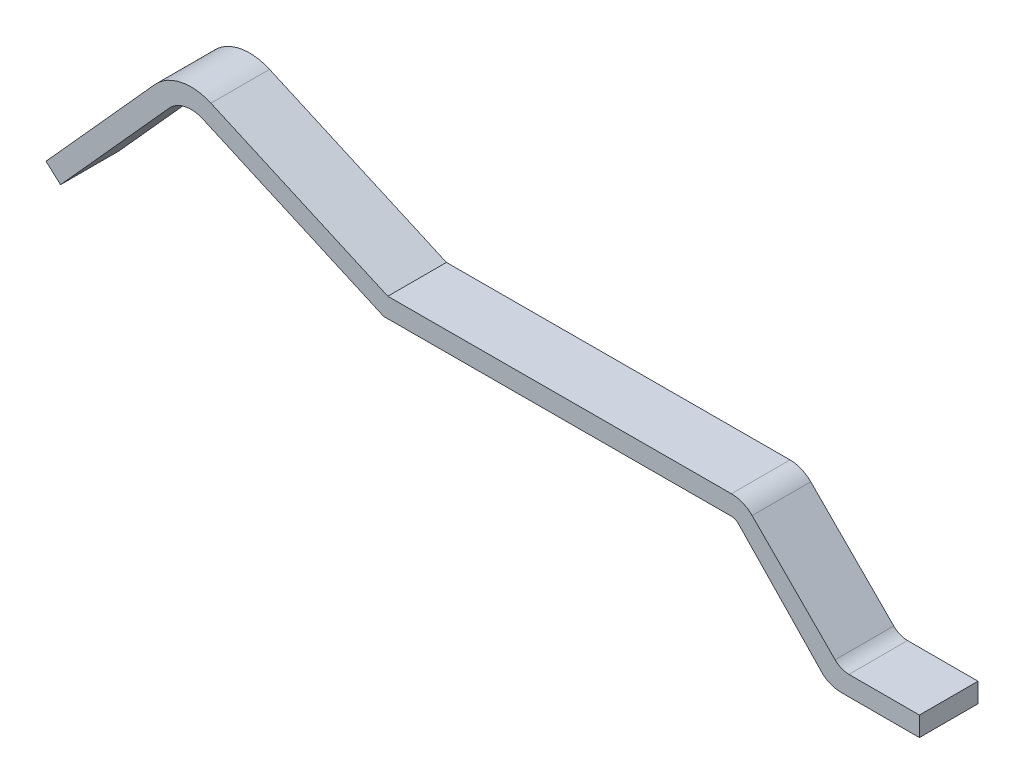
from build123d import *

# Parameters (mm, degrees)
RESSALTO_EXTRUS_O1_DEPTH = 0.3


with BuildPart() as part:
    # Esboço1 → Ressalto-extrusão1 (new, symmetric)
    with BuildSketch(Plane.XY):
        with BuildLine():
            Line((17.891752756, 0.197947805), (17.891752756, -0.002052195))
            Line((17.891752756, -0.002052195), (17.091752756, -0.002052195))
            ThreePointArc((17.091752756, -0.002052195), (16.996884427, 0.013342816), (16.911752756, 0.057947805))
            Line((16.911752756, 0.057947805), (16.038199366, 0.968756691))
            ThreePointArc((16.038199366, 0.968756691), (16.005773821, 0.990473944), (15.967488688, 0.99804386))
            Line((15.967488688, 0.99804386), (12.407488688, 0.99))
            Line((12.407488688, 0.99), (10.557971552, 1.813458083))
            ThreePointArc((10.557971552, 1.813458083), (10.373577052, 1.832838725), (10.213007112, 1.740133627))
            Line((10.213007112, 1.740133627), (9.099531826, 0.503494039))
            Line((9.099531826, 0.503494039), (8.95090286, 0.637320161))
            Line((8.95090286, 0.637320161), (10.064378147, 1.873959748))
            ThreePointArc((10.064378147, 1.873959748), (10.331994714, 2.028468246), (10.639318881, 1.996167174))
            Line((10.639318881, 1.996167174), (12.45, 1.19))
            Line((12.45, 1.19), (15.967488688, 1.197947805))
            ThreePointArc((15.967488688, 1.197947805), (16.082345327, 1.175236263), (16.179620722, 1.11007984))
            Line((16.179620722, 1.11007984), (17.029007121, 0.256846352))
            ThreePointArc((17.029007121, 0.256846352), (17.094002269, 0.213258484), (17.170747658, 0.197947805))
            Line((17.170747658, 0.197947805), (17.891752756, 0.197947805))
        make_face()
    extrude(amount=RESSALTO_EXTRUS_O1_DEPTH, both=True)


solid = part.part
